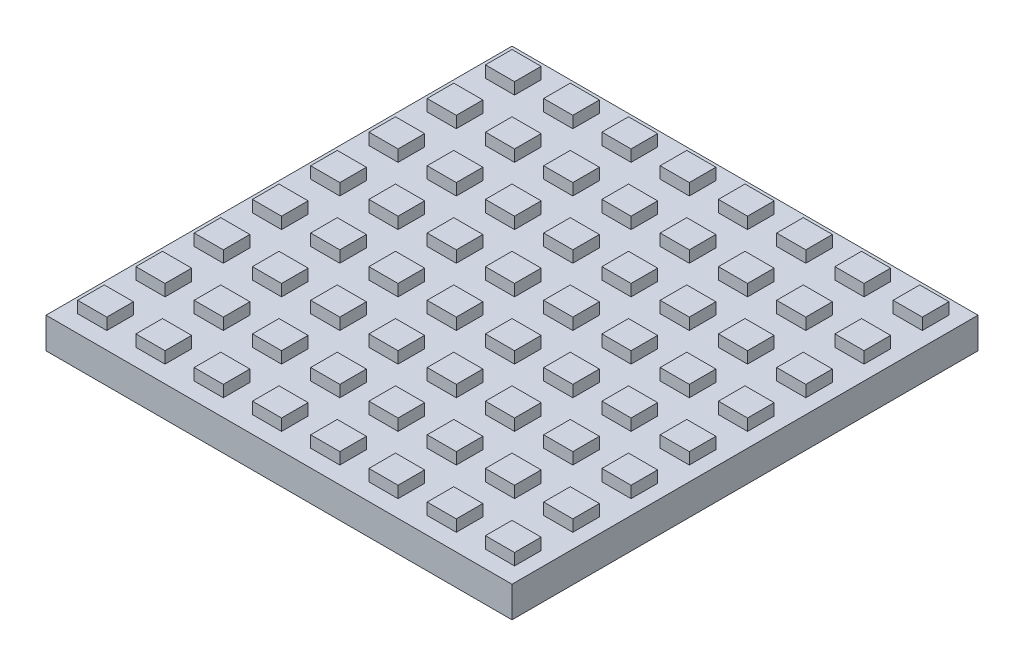
from build123d import *

# Parameters (mm, degrees)
SKETCH1_W            = 80
SKETCH1_H            = 80
BOSS_EXTRUDE1_DEPTH  = 5.3
SKETCH2_W            = 5
SKETCH2_H            = 4.56445203
BOSS_EXTRUDE2_DEPTH  = 2
LPATTERN1_COUNT      = 8
LPATTERN1_PITCH      = 10
LPATTERN1_COUNT_DIR2 = 8
LPATTERN1_PITCH_DIR2 = 10


with BuildPart() as part:
    # Sketch1 → Boss-Extrude1 (new body)
    with BuildSketch(Plane(origin=(0, 0, 0), x_dir=(1, 0, 0), z_dir=(0, 1, 0))):
        with Locations((40, -40)):
            Rectangle(SKETCH1_W, SKETCH1_H)
    extrude(amount=BOSS_EXTRUDE1_DEPTH)

    # Sketch2 → Boss-Extrude2 (add)
    with BuildSketch(Plane(origin=(0, 5.3, 0), x_dir=(1, 0, 0), z_dir=(0, 1, 0))):
        with Locations((5, -4.782226015)):
            Rectangle(SKETCH2_W, SKETCH2_H)
    boss_extrude2 = extrude(amount=BOSS_EXTRUDE2_DEPTH)

    # LPattern1: Boss-Extrude2 8 × 8
    with Locations(*[(i * LPATTERN1_PITCH, 0, j * LPATTERN1_PITCH_DIR2) for i in range(LPATTERN1_COUNT) for j in range(LPATTERN1_COUNT_DIR2) if (i, j) != (0, 0)]):
        add(boss_extrude2)


solid = part.part
